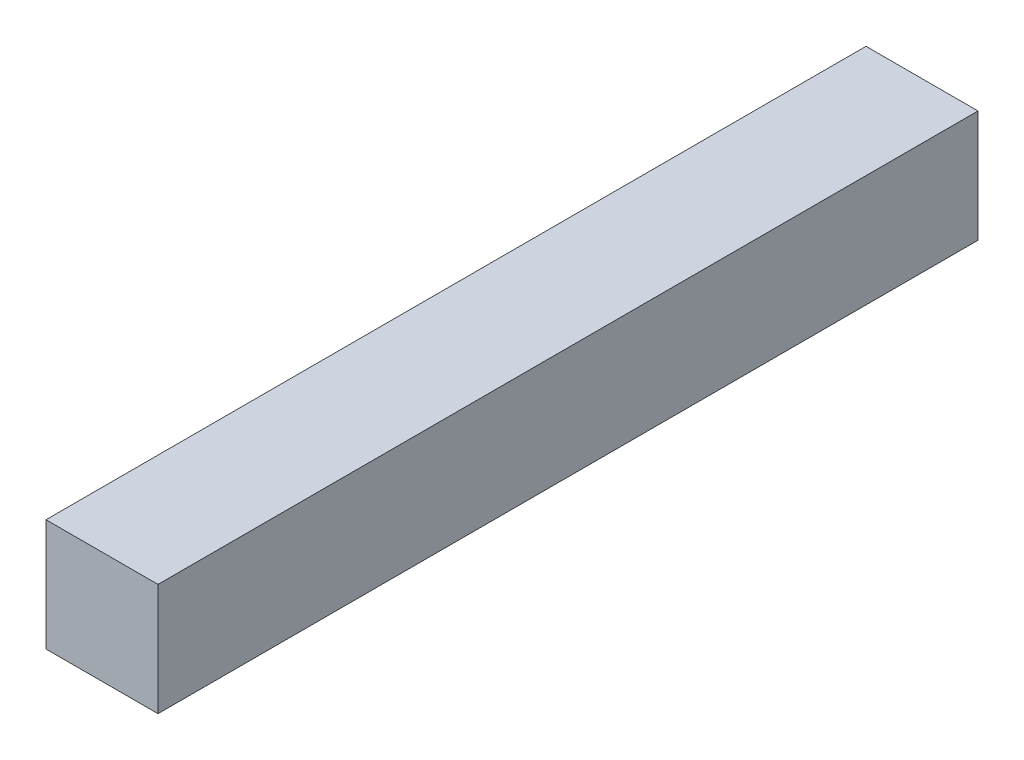
from build123d import *

# Parameters (mm, degrees)
SZKIC1_W                    = 4.78
SZKIC1_H                    = 4.78
DODANIE_WYCI_GNI_CIE1_DEPTH = 35


with BuildPart() as part:
    # Szkic1 → Dodanie-wyciągnięcie1 (new body)
    with BuildSketch(Plane.XY):
        Rectangle(SZKIC1_W, SZKIC1_H)
    extrude(amount=DODANIE_WYCI_GNI_CIE1_DEPTH)


solid = part.part
